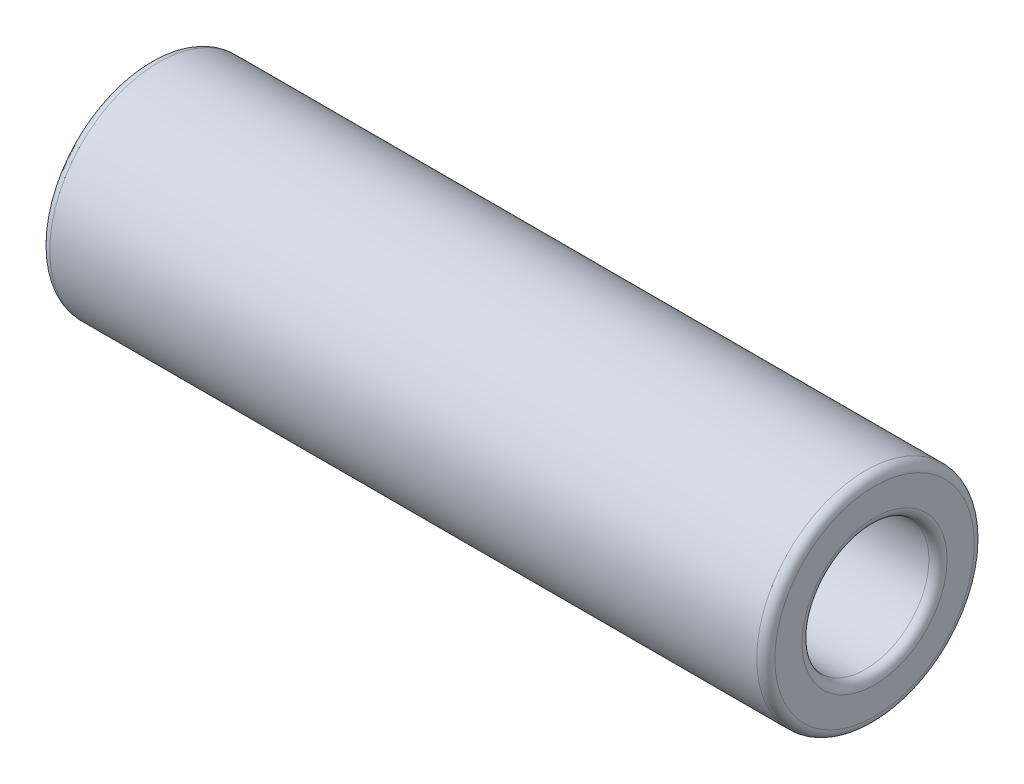
from build123d import *

# Parameters (mm, degrees)
SZKIC1_R                    = 6
SZKIC1_R_2                  = 3.5
DODANIE_WYCI_GNI_CIE1_DEPTH = 40
ZAOKR_GLENIE1_R             = 0.5


with BuildPart() as part:
    # Szkic1 → Dodanie-wyciągnięcie1 (new body)
    with BuildSketch(Plane(origin=(0, 0, 0), x_dir=(0, 0, -1), z_dir=(1, 0, 0))):
        Circle(SZKIC1_R)
        Circle(SZKIC1_R_2, mode=Mode.SUBTRACT)
    extrude(amount=DODANIE_WYCI_GNI_CIE1_DEPTH)

    # Zaokrąglenie1
    zaokr_glenie1_edges = [part.edges().sort_by_distance(p)[0] for p in [
        (0, 0, 6),
        (40, 0, 6),
        (0, 0, 3.5),
        (40, 0, 3.5),
    ]]
    fillet(zaokr_glenie1_edges, radius=ZAOKR_GLENIE1_R)


solid = part.part
